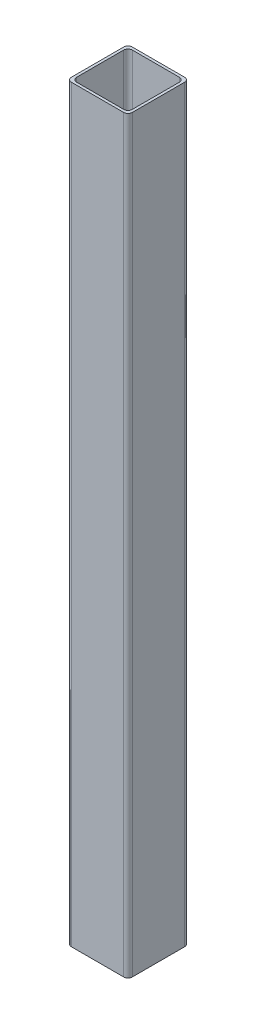
from build123d import *

# Parameters (mm, degrees)
SKETCH1_W           = 70
SKETCH1_H           = 70
SKETCH1_W_2         = 64
SKETCH1_H_2         = 64
BOSS_EXTRUDE1_DEPTH = 860
FILLET1_R           = 5


with BuildPart() as part:
    # Sketch1 → Boss-Extrude1 (new body)
    with BuildSketch(Plane(origin=(0, 0, 0), x_dir=(1, 0, 0), z_dir=(0, 1, 0))):
        with Locations((35, 35)):
            Rectangle(SKETCH1_W, SKETCH1_H)
        with Locations((35, 35)):
            Rectangle(SKETCH1_W_2, SKETCH1_H_2, mode=Mode.SUBTRACT)
    extrude(amount=BOSS_EXTRUDE1_DEPTH)

    # Fillet1
    fillet1_edges = [part.edges().sort_by_distance(p)[0] for p in [
        (3, 430, -67),
        (3, 430, -3),
        (67, 430, -3),
        (67, 430, -67),
        (0, 430, 0),
        (0, 430, -70),
        (70, 430, -70),
        (70, 430, 0),
    ]]
    fillet(fillet1_edges, radius=FILLET1_R)


solid = part.part
